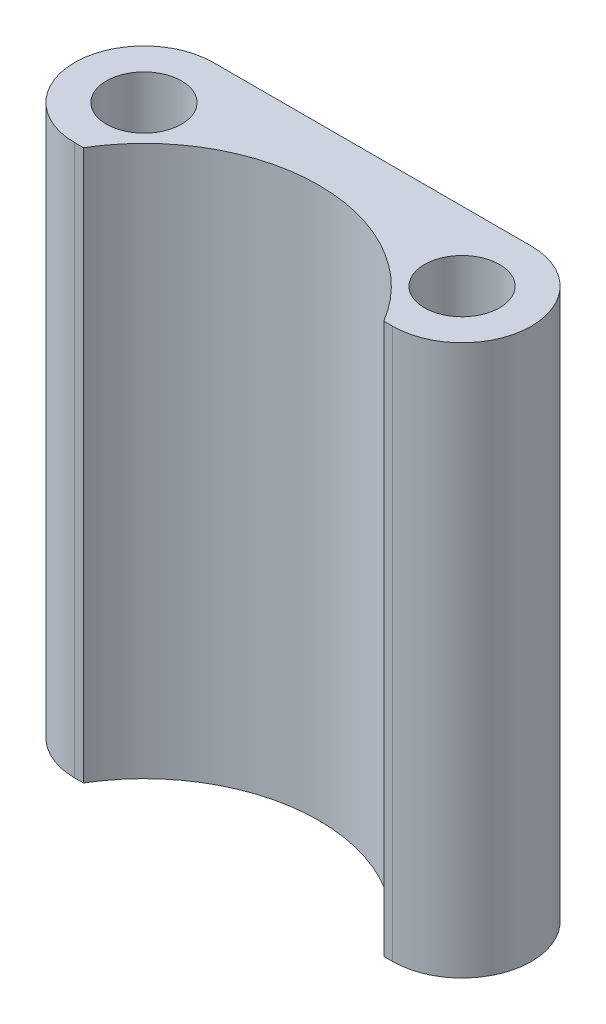
from build123d import *

# Parameters (mm, degrees)
SKETCH1_R           = 3
BOSS_EXTRUDE1_DEPTH = 43.942


with BuildPart() as part:
    # Sketch1 → Boss-Extrude1 (new body)
    with BuildSketch(Plane(origin=(0, 0, 0), x_dir=(1, 0, 0), z_dir=(0, 1, 0))):
        with BuildLine():
            ThreePointArc((-11.995636707, -5.54), (-9.328503626, -2.300965424), (-5.819871132, 0))
            ThreePointArc((-5.819871132, 0), (0, 1.27), (5.819871133, 0))
            ThreePointArc((5.819871133, 0), (9.328503626, -2.300965424), (11.995636707, -5.54))
            Line((11.995636707, -5.54), (12.7, -5.54))
            ThreePointArc((12.7, -5.54), (18.24, 0), (12.7, 5.54))
            Line((12.7, 5.54), (-12.7, 5.54))
            ThreePointArc((-12.7, 5.54), (-18.24, 0), (-12.7, -5.54))
            Line((-12.7, -5.54), (-11.995636707, -5.54))
        make_face()
        with Locations(Location((-12.7, 0, 0), (0, 0, 90))):
            Circle(SKETCH1_R, mode=Mode.SUBTRACT)
        with BuildLine():
            ThreePointArc((15.7, 0), (12.7, -3), (9.7, 0))
            ThreePointArc((9.7, 0), (12.7, 3), (15.7, 0))
        make_face(mode=Mode.SUBTRACT)
    extrude(amount=BOSS_EXTRUDE1_DEPTH)


solid = part.part
